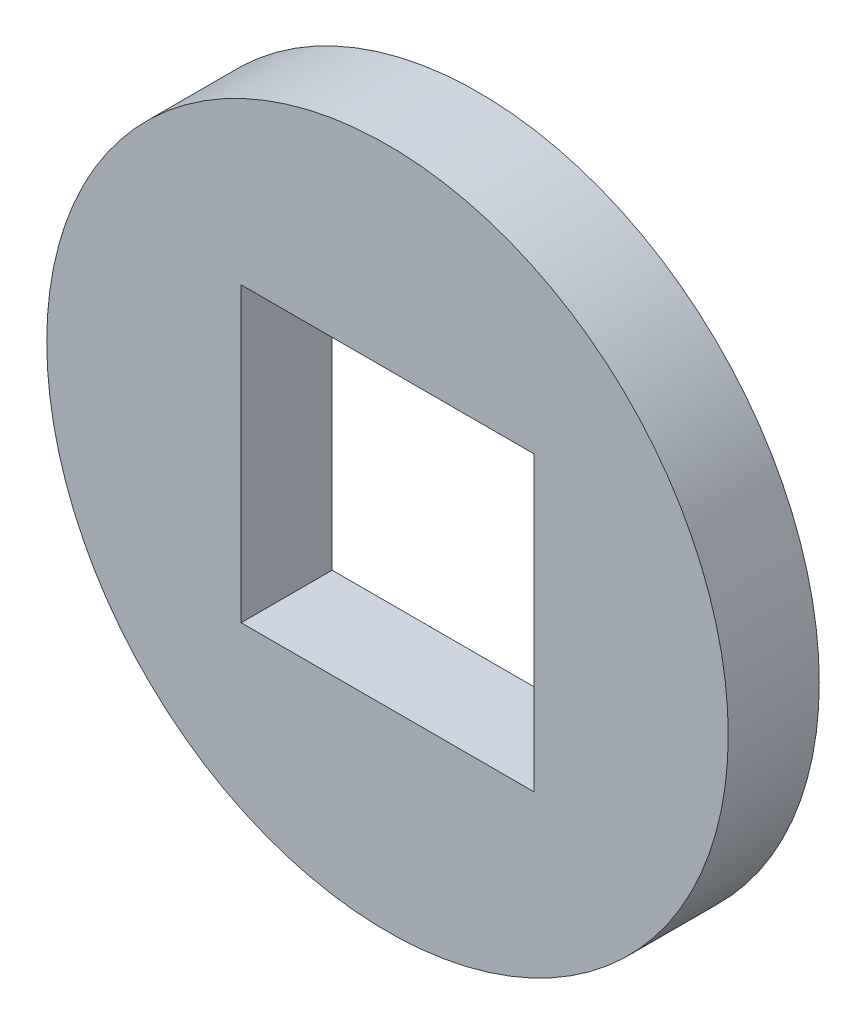
from build123d import *

# Parameters (mm, degrees)
SKETCH1_R           = 10.795
SKETCH1_W           = 9.271
SKETCH1_H           = 9.271
BOSS_EXTRUDE1_DEPTH = 2.8829


with BuildPart() as part:
    # Sketch1 → Boss-Extrude1 (new body)
    with BuildSketch(Plane.XY):
        with Locations(Location((0, 0, 0), (0, 0, 180))):
            Circle(SKETCH1_R)
        Rectangle(SKETCH1_W, SKETCH1_H, mode=Mode.SUBTRACT)
    extrude(amount=BOSS_EXTRUDE1_DEPTH)


solid = part.part
